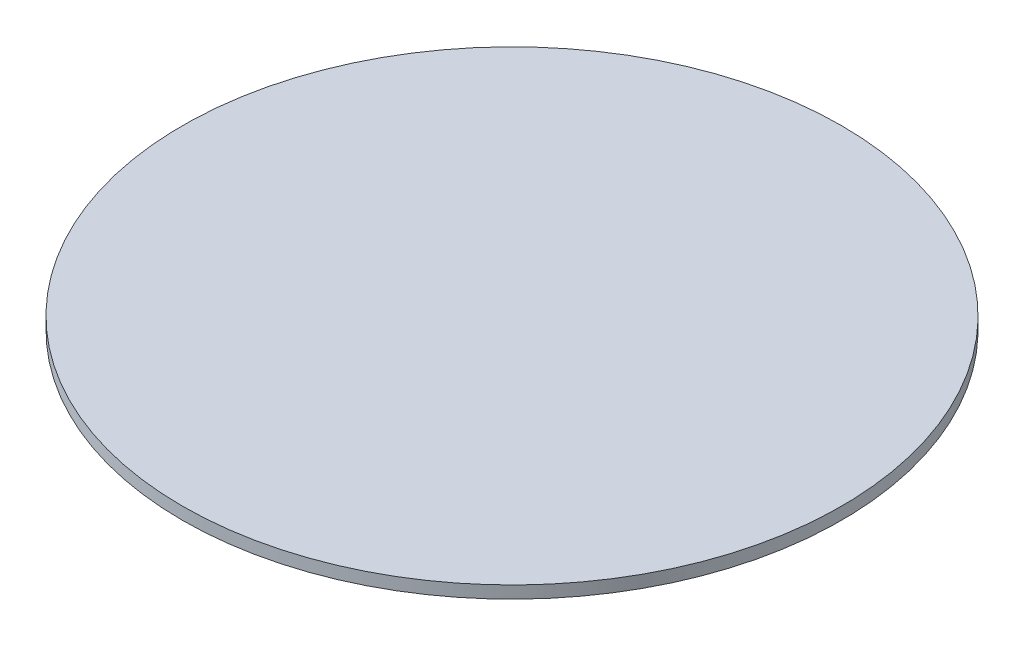
from build123d import *

# Parameters (mm, degrees)
ESQUISSE1_W = 80.310869934
ESQUISSE1_H = 3


with BuildPart() as part:
    # Esquisse1 → Révolution1 (revolve)
    with BuildSketch(Plane.XY, mode=Mode.PRIVATE) as r_volution1_sk:
        with Locations((-40.155434967, 159.620727786)):
            Rectangle(ESQUISSE1_W, ESQUISSE1_H)
    revolve(r_volution1_sk.sketch.rotate(Axis((0, 0, 0), (0, 1, 0)), 270), axis=Axis((0, 0, 0), (0, 1, 0)))


solid = part.part
